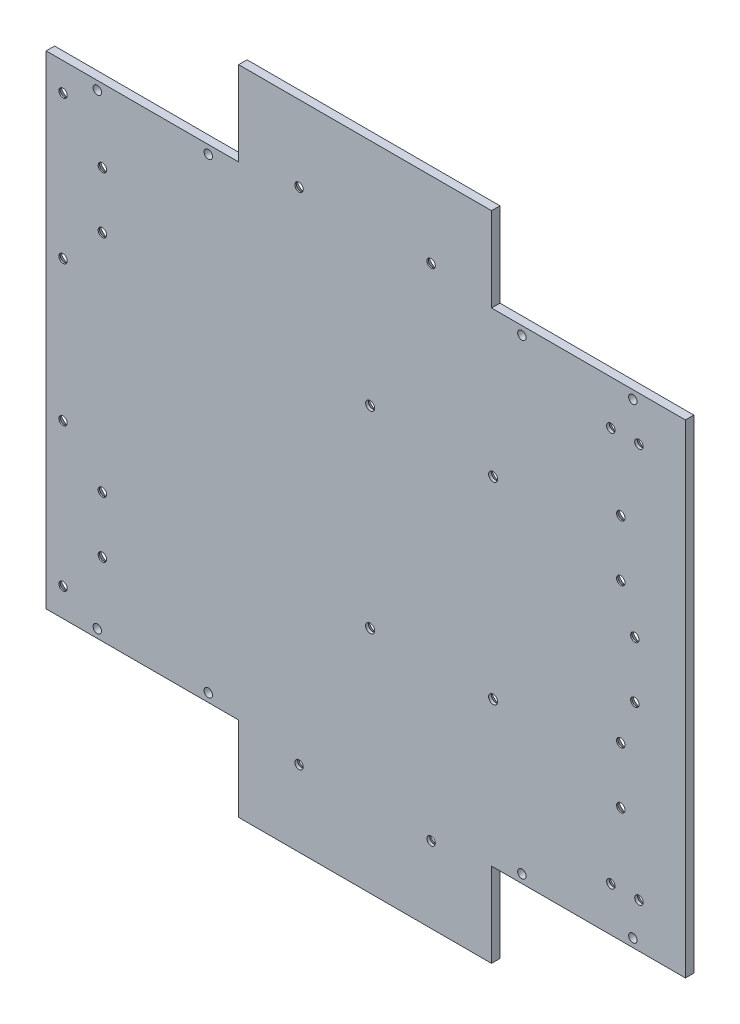
from build123d import *

# Parameters (mm, degrees)
EXTRUDE_1_DEPTH     = 3
SKETCH_2_R          = 1.5
CUT_EXTRUDE_1_DEPTH = 10
SKETCH_3_W          = 10
SKETCH_3_H          = 172
SKETCH_3_W_2        = 90
SKETCH_3_H_2        = 33
EXTRUDE_2_DEPTH     = 3
SKETCH_4_R          = 1.6
CUT_EXTRUDE_2_DEPTH = 10
SKETCH_5_R          = 1.5
CUT_EXTRUDE_3_DEPTH = 10
SKETCH_6_R          = 1.5
CUT_EXTRUDE_4_DEPTH = 10
SKETCH_7_R          = 1.5
CUT_EXTRUDE_5_DEPTH = 74
SKETCH_8_R          = 1.5
CUT_EXTRUDE_6_DEPTH = 10
SKETCH_9_W          = 6
SKETCH_9_H          = 172
EXTRUDE_3_DEPTH     = 3
SKETCH_10_R         = 1.5
CUT_EXTRUDE_7_DEPTH = 15
CHAMFER_2_SIZE      = 2.5
CHAMFER_3_SIZE      = 2.5
CHAMFER_5_SIZE      = 2.5
SKETCH_11_R         = 1.5
CUT_EXTRUDE_8_DEPTH = 10
CHAMFER_6_SIZE      = 2
CHAMFER_7_SIZE      = 2
CHAMFER_8_SIZE      = 2


with BuildPart() as part:
    # 草图1 → 凸台-拉伸1 (new body)
    with BuildSketch(Plane.XY):
        Polygon((-105.75, 86), (-105.75, 70), (-105.75, -86), (105.75, -86), (105.75, 86), align=None)
    extrude(amount=EXTRUDE_1_DEPTH)

    # 草图2 → 切除-拉伸1 (cut)
    with BuildSketch(Plane.XY.offset(3)):
        with Locations((97.05, 83)):
            Circle(SKETCH_2_R)
        with Locations((-93.55, 83)):
            Circle(SKETCH_2_R)
        with Locations((57.55, 83)):
            Circle(SKETCH_2_R)
        with Locations((-54.05, 83)):
            Circle(SKETCH_2_R)
        with Locations((57.55, -83)):
            Circle(SKETCH_2_R)
        with Locations((97.05, -83)):
            Circle(SKETCH_2_R)
        with Locations((-54.05, -83)):
            Circle(SKETCH_2_R)
        with Locations((-93.55, -83)):
            Circle(SKETCH_2_R)
    extrude(amount=-CUT_EXTRUDE_1_DEPTH, mode=Mode.SUBTRACT)

    # 草图3 → 凸台-拉伸2 (add)
    with BuildSketch(Plane.XY.offset(3)):
        with Locations((110.75, 0)):
            Rectangle(SKETCH_3_W, SKETCH_3_H)
        with Locations((1.75, 99.5)):
            Rectangle(SKETCH_3_W_2, SKETCH_3_H_2)
        with Locations((1.75, -99.5)):
            Rectangle(SKETCH_3_W_2, SKETCH_3_H_2)
    extrude(amount=-EXTRUDE_2_DEPTH)

    # 草图4 → 切除-拉伸2 (cut)
    with BuildSketch(Plane.XY.offset(3)):
        with Locations((3.55, 34.3)):
            Circle(SKETCH_4_R)
        with Locations((47.31, 34.3)):
            Circle(SKETCH_4_R)
        with Locations((47.31, -34.3)):
            Circle(SKETCH_4_R)
        with Locations((3.55, -34.3)):
            Circle(SKETCH_4_R)
    extrude(amount=-CUT_EXTRUDE_2_DEPTH, mode=Mode.SUBTRACT)

    # 草图5 → 切除-拉伸3 (cut)
    with BuildSketch(Plane.XY.offset(3)):
        with Locations((92.75, 45)):
            Circle(SKETCH_5_R)
        with Locations((92.75, 25)):
            Circle(SKETCH_5_R)
        with Locations((92.75, -25)):
            Circle(SKETCH_5_R)
        with Locations((92.75, -45)):
            Circle(SKETCH_5_R)
    extrude(amount=-CUT_EXTRUDE_3_DEPTH, mode=Mode.SUBTRACT)

    # 草图6 → 切除-拉伸4 (cut)
    with BuildSketch(Plane.XY.offset(3)):
        with Locations((25.25, -89)):
            Circle(SKETCH_6_R)
        with Locations((-21.75, 89)):
            Circle(SKETCH_6_R)
        with Locations((25.25, 89)):
            Circle(SKETCH_6_R)
        with Locations((-21.75, -89)):
            Circle(SKETCH_6_R)
    extrude(amount=-CUT_EXTRUDE_4_DEPTH, mode=Mode.SUBTRACT)

    # 草图7 → 切除-拉伸5 (cut)
    with BuildSketch(Plane(origin=(0, 0, 0), x_dir=(-1, 0, 0), z_dir=(0, 0, -1))):
        with Locations((91.75, -60)):
            Circle(SKETCH_7_R)
        with Locations((91.75, -40)):
            Circle(SKETCH_7_R)
        with Locations((91.75, 60)):
            Circle(SKETCH_7_R)
        with Locations((91.75, 40)):
            Circle(SKETCH_7_R)
    extrude(amount=-CUT_EXTRUDE_5_DEPTH, mode=Mode.SUBTRACT)

    # 草图8 → 切除-拉伸6 (cut)
    with BuildSketch(Plane(origin=(0, 0, 0), x_dir=(-1, 0, 0), z_dir=(0, 0, -1))):
        with Locations((-97.75, 10)):
            Circle(SKETCH_8_R)
        with Locations((-97.75, -10)):
            Circle(SKETCH_8_R)
    extrude(amount=-CUT_EXTRUDE_6_DEPTH, mode=Mode.SUBTRACT)

    # 草图9 → 凸台-拉伸3 (add)
    with BuildSketch(Plane(origin=(0, 0, 0), x_dir=(-1, 0, 0), z_dir=(0, 0, -1))):
        with Locations((108.75, 0)):
            Rectangle(SKETCH_9_W, SKETCH_9_H)
    extrude(amount=-EXTRUDE_3_DEPTH)

    # 草图10 → 切除-拉伸7 (cut)
    with BuildSketch(Plane(origin=(0, 0, 0), x_dir=(-1, 0, 0), z_dir=(0, 0, -1))):
        with Locations((105.75, 76)):
            Circle(SKETCH_10_R)
        with Locations((105.75, 25)):
            Circle(SKETCH_10_R)
        with Locations((105.75, -25)):
            Circle(SKETCH_10_R)
        with Locations((105.75, -76)):
            Circle(SKETCH_10_R)
    extrude(amount=-CUT_EXTRUDE_7_DEPTH, mode=Mode.SUBTRACT)

    # 倒角2
    chamfer_2_edges = [part.edges().sort_by_distance(p)[0] for p in [
        (23.75, 89, 0),
    ]]
    chamfer(chamfer_2_edges, length=CHAMFER_2_SIZE)

    # 倒角3
    chamfer_3_edges = [part.edges().sort_by_distance(p)[0] for p in [
        (-23.25, 89, 0),
        (-90.25, -60, 0),
        (-90.25, -40, 0),
        (-90.25, 60, 0),
        (-90.25, 40, 0),
        (-104.25, 76, 0),
        (-104.25, 25, 0),
        (-104.25, -25, 0),
        (-104.25, -76, 0),
    ]]
    chamfer(chamfer_3_edges, length=CHAMFER_3_SIZE)

    # 倒角5
    chamfer_5_edges = [part.edges().sort_by_distance(p)[0] for p in [
        (91.25, 45, 0),
        (91.25, 25, 0),
        (91.25, -25, 0),
        (91.25, -45, 0),
        (99.25, 10, 0),
        (99.25, -10, 0),
    ]]
    chamfer(chamfer_5_edges, length=CHAMFER_5_SIZE)

    # 草图11 → 切除-拉伸8 (cut)
    with BuildSketch(Plane(origin=(0, 0, 0), x_dir=(-1, 0, 0), z_dir=(0, 0, -1))):
        with Locations((-89.209242617, 70.25)):
            Circle(SKETCH_11_R)
        with Locations((-99.209242617, 70.25)):
            Circle(SKETCH_11_R)
    cut_extrude_8 = extrude(amount=-CUT_EXTRUDE_8_DEPTH, mode=Mode.SUBTRACT)

    # 镜向2: 切除-拉伸8 across plane
    add(cut_extrude_8.mirror(Plane.ZX), mode=Mode.SUBTRACT)

    # 倒角6
    chamfer_6_edges = [part.edges().sort_by_distance(p)[0] for p in [
        (45.71, 34.3, 0),
    ]]
    chamfer(chamfer_6_edges, length=CHAMFER_6_SIZE)

    # 倒角7
    chamfer_7_edges = [part.edges().sort_by_distance(p)[0] for p in [
        (1.95, 34.3, 0),
        (45.71, -34.3, 0),
        (1.95, -34.3, 0),
        (90.709242617, 70.25, 0),
        (100.709242617, 70.25, 0),
        (90.709242617, -70.25, 0),
        (100.709242617, -70.25, 0),
    ]]
    chamfer(chamfer_7_edges, length=CHAMFER_7_SIZE)

    # 倒角8
    chamfer_8_edges = [part.edges().sort_by_distance(p)[0] for p in [
        (23.75, -89, 0),
        (-23.25, -89, 0),
    ]]
    chamfer(chamfer_8_edges, length=CHAMFER_8_SIZE)

    # 镜向1: 切除-拉伸8 across plane
    add(cut_extrude_8.mirror(Plane.ZX), mode=Mode.SUBTRACT)


solid = part.part
